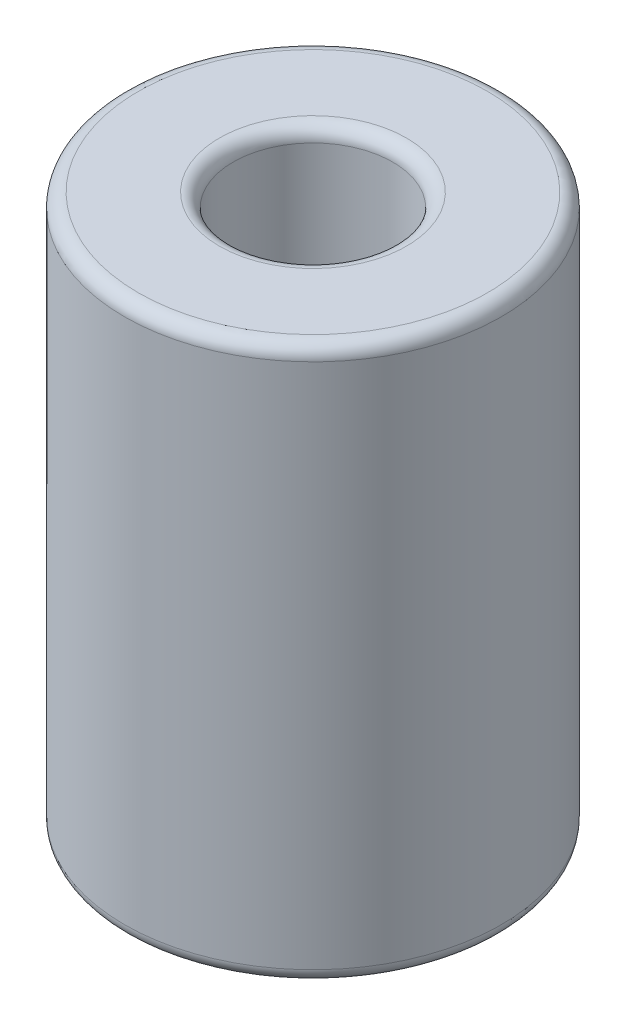
from build123d import *

# Parameters (mm, degrees)
SKETCH1_R           = 5.3975
SKETCH1_R_2         = 2.286
BOSS_EXTRUDE1_DEPTH = 15.875
FILLET1_R           = 0.396875


with BuildPart() as part:
    # Sketch1 → Boss-Extrude1 (new body)
    with BuildSketch(Plane(origin=(0, 0, 0), x_dir=(1, 0, 0), z_dir=(0, 1, 0))):
        with Locations(Location((0, 0, 0), (0, 0, 270))):
            Circle(SKETCH1_R)
        with Locations(Location((0, 0, 0), (0, 0, 270))):
            Circle(SKETCH1_R_2, mode=Mode.SUBTRACT)
    extrude(amount=BOSS_EXTRUDE1_DEPTH)

    # Fillet1
    fillet1_edges = [part.edges().sort_by_distance(p)[0] for p in [
        (0, 0, -5.3975),
        (0, 15.875, -5.3975),
        (0, 0, -2.286),
        (0, 15.875, -2.286),
    ]]
    fillet(fillet1_edges, radius=FILLET1_R)


solid = part.part
